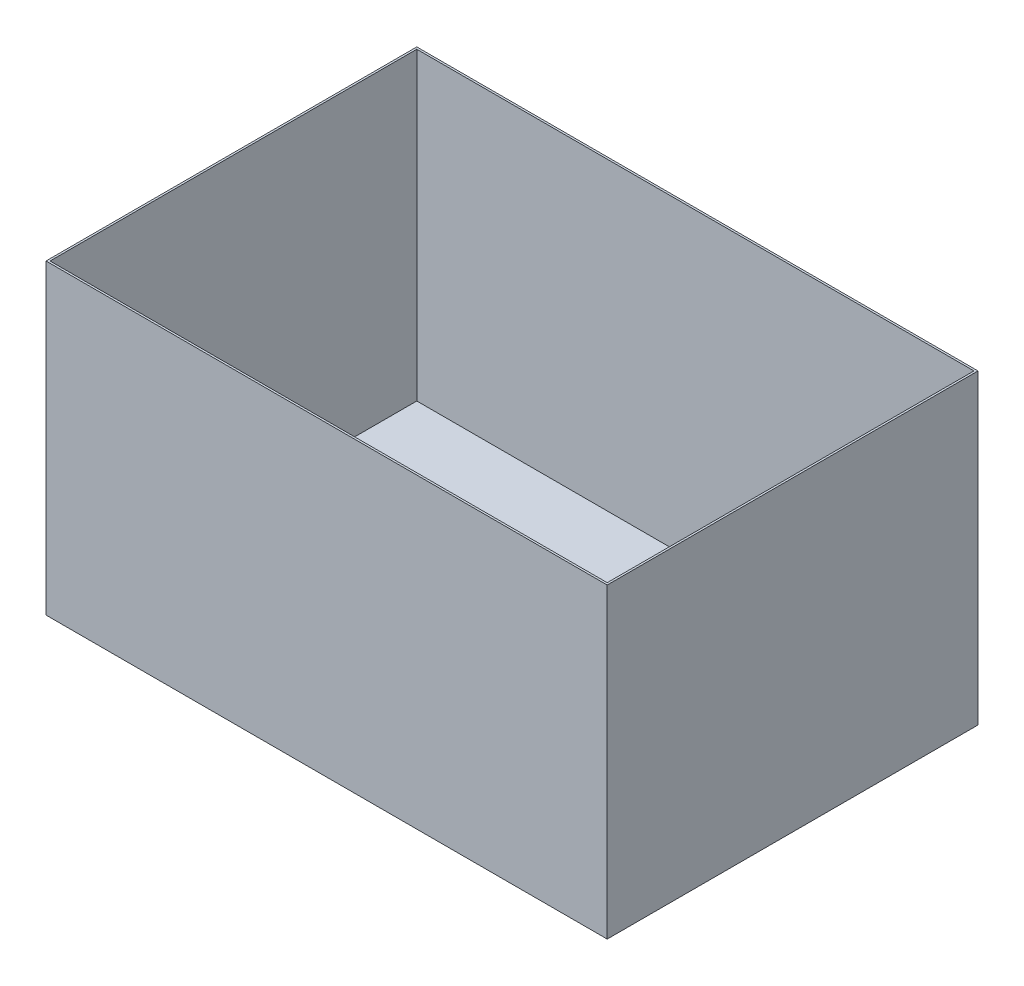
from build123d import *

# Parameters (mm, degrees)
SKETCH1_W           = 711.2
SKETCH1_H           = 469.9
BOSS_EXTRUDE1_DEPTH = 388.62
SHELL1_T            = -2.54


with BuildPart() as part:
    # Sketch1 → Boss-Extrude1 (new body)
    with BuildSketch(Plane(origin=(0, 0, 0), x_dir=(1, 0, 0), z_dir=(0, 1, 0))):
        Rectangle(SKETCH1_W, SKETCH1_H)
    extrude(amount=BOSS_EXTRUDE1_DEPTH)

    # Shell1
    shell1_openings = [part.faces().sort_by_distance(p)[0] for p in [
        (0, 388.62, 0),
    ]]
    offset(amount=SHELL1_T, openings=shell1_openings, kind=Kind.INTERSECTION)


solid = part.part
